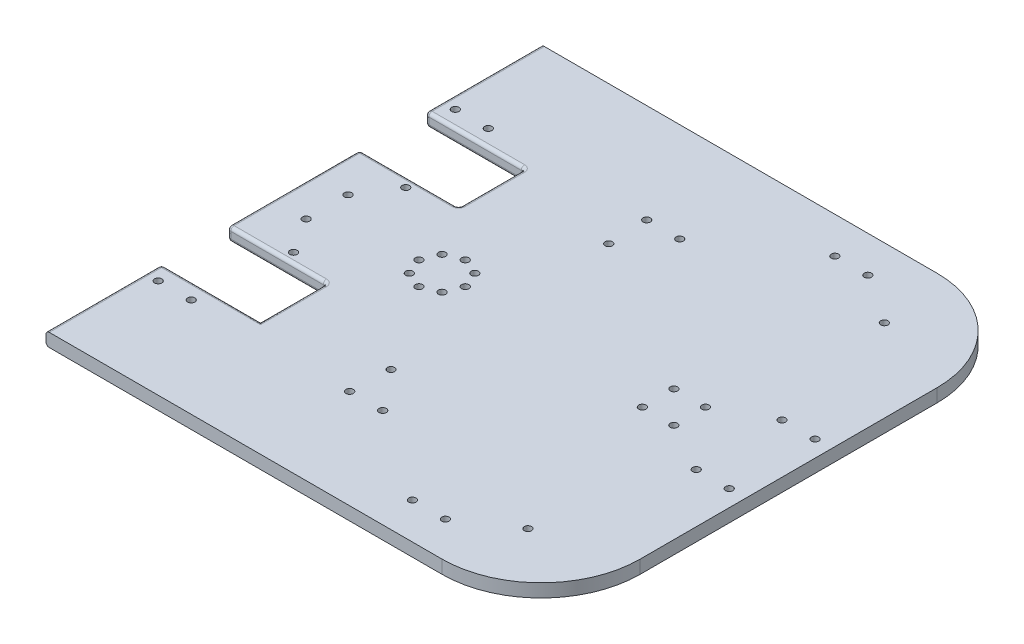
from build123d import *

# Parameters (mm, degrees)
SKETCH_1_W                            = 300
SKETCH_1_H                            = 150
EXTRUDE_1_DEPTH                       = 4
FILLET_4_R                            = 30
FILLET_5_R                            = 30
FILLET_6_R                            = 30
FILLET_7_R                            = 30
HOLE_WIZARD_2_2_2_2_1_D               = 2.2
PATTERN_CIRCULAR_1_COUNT              = 8
MIRROR_1_COPY_1_D                     = 2.2
MIRROR_1_COPY_2_D                     = 2.2
MIRROR_1_COPY_3_D                     = 2.2
MIRROR_1_COPY_4_D                     = 2.2
MIRROR_1_COPY_5_D                     = 2.2
MIRROR_1_COPY_6_D                     = 2.2
MIRROR_1_COPY_7_D                     = 2.2
HOLE_WIZARD_2_2_2_2_2_D               = 2.2
HOLE_WIZARD_2_2_2_2_4_D               = 2.2
F_2_2_2_2_DIAMETER_HOLE1_D            = 2.2
MIRROR_5_AT_THE_SECOND_PLANE_COPY_1_D = 2.2
HOLE_WIZARD_2_2_2_2_6_D               = 2.2
F_2_2_2_2_DIAMETER_HOLE2_D            = 2.2
MIRROR_6_AT_THE_SECOND_PLANE_COPY_1_D = 2.2
F_2_2_2_2_DIAMETER_HOLE3_D            = 2.2
F_2_2_2_2_DIAMETER_HOLE4_D            = 2.2
MIRROR_8_AT_THE_SECOND_PLANE_COPY_1_D = 2.2
F_2_2_2_2_DIAMETER_HOLE5_D            = 2.2
MIRROR_9_AT_THE_SECOND_PLANE_COPY_1_D = 2.2
CUT_EXTRUDE_3_DEPTH                   = 168.752794314
CUT_EXTRUDE_3_DEPTH_BACK              = 168.752794314
SKETCH_25_W                           = 150
SKETCH_25_H                           = 4
SKETCH_28_W                           = 30
SKETCH_28_H                           = 20
CUT_EXTRUDE_4_DEPTH                   = 168.752794314
FILLET_8_R                            = 1


with BuildPart() as part:
    # 草图1 → 凸台-拉伸1 (new body)
    with BuildSketch(Plane(origin=(0, 0, 0), x_dir=(1, 0, 0), z_dir=(0, 1, 0))):
        Rectangle(SKETCH_1_W, SKETCH_1_H)
    extrude(amount=EXTRUDE_1_DEPTH)

    # 圆角4
    fillet_4_edges = [part.edges().sort_by_distance(p)[0] for p in [
        (-150, 2, 75),
    ]]
    fillet(fillet_4_edges, radius=FILLET_4_R)

    # 圆角5
    fillet_5_edges = [part.edges().sort_by_distance(p)[0] for p in [
        (-150, 2, -75),
    ]]
    fillet(fillet_5_edges, radius=FILLET_5_R)

    # 圆角6
    fillet_6_edges = [part.edges().sort_by_distance(p)[0] for p in [
        (150, 2, -75),
    ]]
    fillet(fillet_6_edges, radius=FILLET_6_R)

    # 圆角7
    fillet_7_edges = [part.edges().sort_by_distance(p)[0] for p in [
        (150, 2, 75),
    ]]
    fillet(fillet_7_edges, radius=FILLET_7_R)

    # Ø2.2 (2.2) 直径孔1 (through all)
    with Locations(Plane(origin=(0, 0, 0), x_dir=(-1, 0, 0), z_dir=(0, -1, 0))):
        with Locations((45, -7.02)):
            hole_wizard_2_2_2_2_1 = Hole(HOLE_WIZARD_2_2_2_2_1_D / 2)

    # 阵列(圆周)1: Ø2.2 (2.2) 直径孔1 ×8 about axis
    pattern_circular_1_axis = Axis((-45, 0, 0), (0, 1, 0))
    for i in range(1, PATTERN_CIRCULAR_1_COUNT):
        add(hole_wizard_2_2_2_2_1.rotate(pattern_circular_1_axis, i * 360 / PATTERN_CIRCULAR_1_COUNT), mode=Mode.SUBTRACT)

    # 镜向1: Ø2.2 (2.2) 直径孔1 across plane
    add(hole_wizard_2_2_2_2_1.mirror(Plane(origin=(0, 0, 0), x_dir=(0, 0, 1), z_dir=(1, 0, 0))), mode=Mode.SUBTRACT)

    # 镜向1 copy 1 (through all)
    with Locations(Plane(origin=(13.180194847, 0, -31.819805153), x_dir=(0.7071067811865476, 0, 0.7071067811865475), z_dir=(0, -1, 0))):
        with Locations((45, 7.02)):
            Hole(MIRROR_1_COPY_1_D / 2)

    # 镜向1 copy 2 (through all)
    with Locations(Plane(origin=(45, 0, -45), x_dir=(0, 0, 1), z_dir=(0, -1, 0))):
        with Locations((45, 7.02)):
            Hole(MIRROR_1_COPY_2_D / 2)

    # 镜向1 copy 3 (through all)
    with Locations(Plane(origin=(76.819805153, 0, -31.819805153), x_dir=(-0.7071067811865475, 0, 0.7071067811865476), z_dir=(0, -1, 0))):
        with Locations((45, 7.02)):
            Hole(MIRROR_1_COPY_3_D / 2)

    # 镜向1 copy 4 (through all)
    with Locations(Plane(origin=(90, 0, 0), x_dir=(-1, 0, 0), z_dir=(0, -1, 0))):
        with Locations((45, 7.02)):
            Hole(MIRROR_1_COPY_4_D / 2)

    # 镜向1 copy 5 (through all)
    with Locations(Plane(origin=(76.819805153, 0, 31.819805153), x_dir=(-0.7071067811865477, 0, -0.7071067811865475), z_dir=(0, -1, 0))):
        with Locations((45, 7.02)):
            Hole(MIRROR_1_COPY_5_D / 2)

    # 镜向1 copy 6 (through all)
    with Locations(Plane(origin=(45, 0, 45), x_dir=(0, 0, -1), z_dir=(0, -1, 0))):
        with Locations((45, 7.02)):
            Hole(MIRROR_1_COPY_6_D / 2)

    # 镜向1 copy 7 (through all)
    with Locations(Plane(origin=(13.180194847, 0, 31.819805153), x_dir=(0.7071067811865474, 0, -0.7071067811865477), z_dir=(0, -1, 0))):
        with Locations((45, 7.02)):
            Hole(MIRROR_1_COPY_7_D / 2)

    # Ø2.2 (2.2) 直径孔2 (through all)
    with Locations(Plane(origin=(0, 0, 0), x_dir=(-1, 0, 0), z_dir=(0, -1, 0))):
        with Locations((120, 4.78), (120, -4.775), (110.45, -4.775), (110.45, 4.78)):
            hole_wizard_2_2_2_2_2 = Hole(HOLE_WIZARD_2_2_2_2_2_D / 2)

    # 镜向2: Ø2.2 (2.2) 直径孔2 across plane
    add(hole_wizard_2_2_2_2_2.mirror(Plane(origin=(0, 0, 0), x_dir=(0, 0, 1), z_dir=(1, 0, 0))), mode=Mode.SUBTRACT)

    # Ø2.2 (2.2) 直径孔4 (through all)
    with Locations(Plane(origin=(0, 4, 0), x_dir=(1, 0, 0), z_dir=(0, 1, 0))):
        with Locations((100, -64), (110, -64), (-100, -64), (-110, -64)):
            hole_wizard_2_2_2_2_4 = Hole(HOLE_WIZARD_2_2_2_2_4_D / 2)

    # 镜向4: Ø2.2 (2.2) 直径孔4 across plane
    add(hole_wizard_2_2_2_2_4.mirror(Plane.XY), mode=Mode.SUBTRACT)

    # Ø2.2 (2.2) Diameter Hole1 (through all)
    with Locations(Plane(origin=(0, 4, 0), x_dir=(1, 0, 0), z_dir=(0, 1, 0))):
        with Locations((-125, 54)):
            f_2_2_2_2_diameter_hole1 = Hole(F_2_2_2_2_DIAMETER_HOLE1_D / 2)

    # 镜向5: Ø2.2 (2.2) Diameter Hole1 across plane
    add(f_2_2_2_2_diameter_hole1.mirror(Plane(origin=(0, 0, 0), x_dir=(0, 0, 1), z_dir=(1, 0, 0))), mode=Mode.SUBTRACT)

    # 镜向5 at the second plane: Ø2.2 (2.2) Diameter Hole1 across plane
    add(f_2_2_2_2_diameter_hole1.mirror(Plane.XY), mode=Mode.SUBTRACT)

    # 镜向5 at the second plane copy 1 (through all)
    with Locations(Plane(origin=(0, 4, 0), x_dir=(-1, 0, 0), z_dir=(0, 1, 0))):
        with Locations((-125, 54)):
            Hole(MIRROR_5_AT_THE_SECOND_PLANE_COPY_1_D / 2)

    # Ø2.2 (2.2) 直径孔6 (through all)
    with Locations(Plane(origin=(0, 4, 0), x_dir=(1, 0, 0), z_dir=(0, 1, 0))):
        with Locations((-62.5, 33), (-62.5, -33), (62.5, -33), (62.5, 33)):
            Hole(HOLE_WIZARD_2_2_2_2_6_D / 2)

    # Ø2.2 (2.2) Diameter Hole2 (through all)
    with Locations(Plane(origin=(0, 4, 0), x_dir=(1, 0, 0), z_dir=(0, 1, 0))):
        with Locations((-145, 13), (-135, 13)):
            f_2_2_2_2_diameter_hole2 = Hole(F_2_2_2_2_DIAMETER_HOLE2_D / 2)

    # 镜向6: Ø2.2 (2.2) Diameter Hole2 across plane
    add(f_2_2_2_2_diameter_hole2.mirror(Plane(origin=(0, 0, 0), x_dir=(0, 0, 1), z_dir=(1, 0, 0))), mode=Mode.SUBTRACT)

    # 镜向6 at the second plane: Ø2.2 (2.2) Diameter Hole2 across plane
    add(f_2_2_2_2_diameter_hole2.mirror(Plane.XY), mode=Mode.SUBTRACT)

    # 镜向6 at the second plane copy 1 (through all)
    with Locations(Plane(origin=(0, 4, 0), x_dir=(-1, 0, 0), z_dir=(0, 1, 0))):
        with Locations((-145, 13), (-135, 13)):
            Hole(MIRROR_6_AT_THE_SECOND_PLANE_COPY_1_D / 2)

    # Ø2.2 (2.2) Diameter Hole3 (through all)
    with Locations(Plane(origin=(0, 4, 0), x_dir=(1, 0, 0), z_dir=(0, 1, 0))):
        with Locations((-80, 45), (-70, 45), (-46, 45), (-36, 45), (4, 45), (14, 45), (62, 45), (72, 45)):
            f_2_2_2_2_diameter_hole3 = Hole(F_2_2_2_2_DIAMETER_HOLE3_D / 2)

    # 镜向7: Ø2.2 (2.2) Diameter Hole3 across plane
    add(f_2_2_2_2_diameter_hole3.mirror(Plane.XY), mode=Mode.SUBTRACT)

    # Ø2.2 (2.2) Diameter Hole4 (through all)
    with Locations(Plane.XZ):
        with Locations((-10.16, 6.35)):
            f_2_2_2_2_diameter_hole4 = Hole(F_2_2_2_2_DIAMETER_HOLE4_D / 2)

    # 镜向8: Ø2.2 (2.2) Diameter Hole4 across plane
    add(f_2_2_2_2_diameter_hole4.mirror(Plane.XY), mode=Mode.SUBTRACT)

    # 镜向8 at the second plane: Ø2.2 (2.2) Diameter Hole4 across plane
    add(f_2_2_2_2_diameter_hole4.mirror(Plane(origin=(0, 0, 0), x_dir=(0, 0, 1), z_dir=(1, 0, 0))), mode=Mode.SUBTRACT)

    # 镜向8 at the second plane copy 1 (through all)
    with Locations(Plane(origin=(0, 0, 0), x_dir=(-1, 0, 0), z_dir=(0, -1, 0))):
        with Locations((-10.16, 6.35)):
            Hole(MIRROR_8_AT_THE_SECOND_PLANE_COPY_1_D / 2)

    # Ø2.2 (2.2) Diameter Hole5 (through all)
    with Locations(Plane(origin=(0, 4, 0), x_dir=(1, 0, 0), z_dir=(0, 1, 0))):
        with Locations((-17, 17)):
            f_2_2_2_2_diameter_hole5 = Hole(F_2_2_2_2_DIAMETER_HOLE5_D / 2)

    # 镜向9: Ø2.2 (2.2) Diameter Hole5 across plane
    add(f_2_2_2_2_diameter_hole5.mirror(Plane.XY), mode=Mode.SUBTRACT)

    # 镜向9 at the second plane: Ø2.2 (2.2) Diameter Hole5 across plane
    add(f_2_2_2_2_diameter_hole5.mirror(Plane(origin=(0, 0, 0), x_dir=(0, 0, 1), z_dir=(1, 0, 0))), mode=Mode.SUBTRACT)

    # 镜向9 at the second plane copy 1 (through all)
    with Locations(Plane(origin=(0, 4, 0), x_dir=(-1, 0, 0), z_dir=(0, 1, 0))):
        with Locations((-17, 17)):
            Hole(MIRROR_9_AT_THE_SECOND_PLANE_COPY_1_D / 2)

    # 草图25 → 切除-拉伸3 (cut, two sides: drawn at the far end of the back side and taken through both)
    with BuildSketch(Plane.XY.offset(-CUT_EXTRUDE_3_DEPTH_BACK)):
        with Locations((-75, 2)):
            Rectangle(SKETCH_25_W, SKETCH_25_H)
    extrude(amount=CUT_EXTRUDE_3_DEPTH + CUT_EXTRUDE_3_DEPTH_BACK, mode=Mode.SUBTRACT)

    # 草图28 → 切除-拉伸4 (cut, through all)
    with BuildSketch(Plane(origin=(0, 4, 0), x_dir=(1, 0, 0), z_dir=(0, 1, 0))):
        with Locations((15, 30)):
            Rectangle(SKETCH_28_W, SKETCH_28_H)
    cut_extrude_4 = extrude(amount=-CUT_EXTRUDE_4_DEPTH, mode=Mode.SUBTRACT)

    # 镜向10: 切除-拉伸4 across plane
    add(cut_extrude_4.mirror(Plane.XY), mode=Mode.SUBTRACT)

    # 圆角8
    fillet_8_edges = [part.edges().sort_by_distance(p)[0] for p in [
        (0, 0, -57.5),
        (0, 4, -57.5),
        (0, 4, 0),
        (0, 0, 0),
        (30, 0, -30),
        (30, 2, -40),
        (15, 0, -20),
        (30, 2, -20),
        (0, 2, -20),
        (15, 0, -40),
        (0, 2, -40),
        (30, 4, -30),
        (15, 4, -40),
        (15, 4, -20),
        (0, 4, 57.5),
        (0, 0, 57.5),
        (30, 4, 30),
        (30, 2, 20),
        (15, 4, 40),
        (0, 2, 40),
        (15, 4, 20),
        (0, 2, 20),
        (30, 0, 30),
        (15, 0, 40),
        (15, 0, 20),
    ]]
    fillet(fillet_8_edges, radius=FILLET_8_R)


solid = part.part
